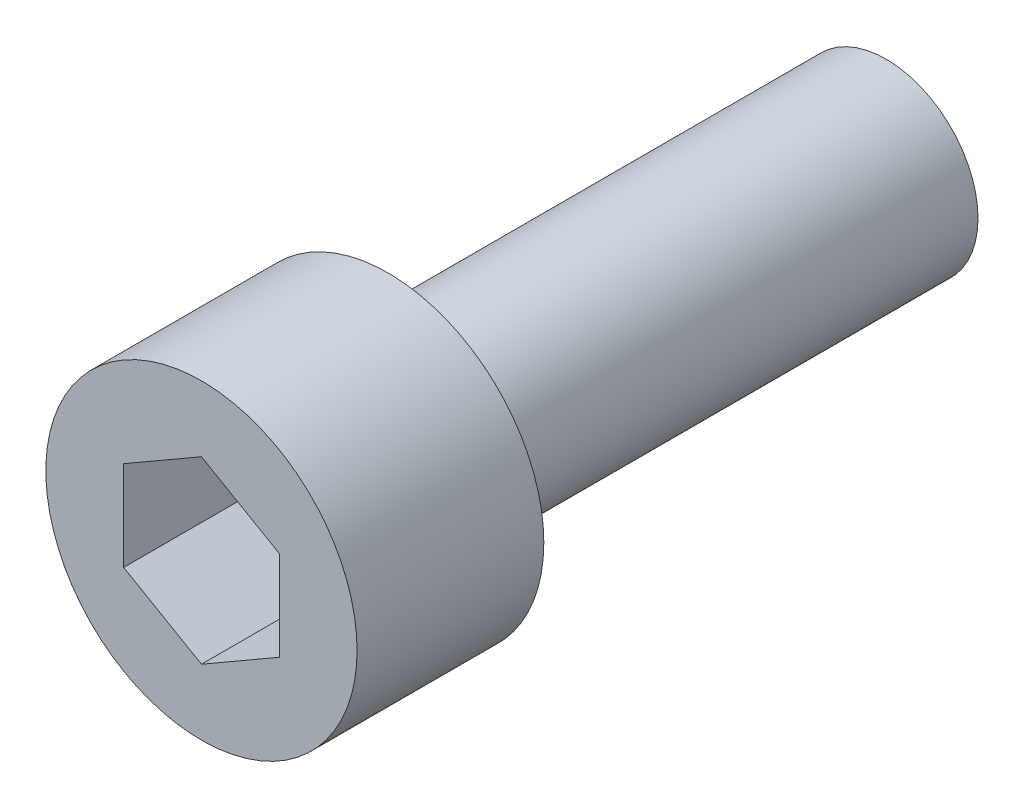
from build123d import *

# Parameters (mm, degrees)
SKETCH_1_R                     = 2.95
SHANK_THREADS_SIMPLIFIED_DEPTH = 16
SKETCH_2_R                     = 5
SOCKET_HEAD_DEPTH              = 6
HEX_SOCKET_DEPTH               = 3.9


with BuildPart() as part:
    # 草图1 → Shank_threads_simplified (new body)
    with BuildSketch(Plane.XY):
        Circle(SKETCH_1_R)
    extrude(amount=-SHANK_THREADS_SIMPLIFIED_DEPTH)

    # 草图2 → Socket_head (add)
    with BuildSketch(Plane.XY):
        Circle(SKETCH_2_R)
    extrude(amount=SOCKET_HEAD_DEPTH)

    # 草图3 → Hex_socket (cut)
    with BuildSketch(Plane.XY.offset(6)):
        Polygon((2.5, 1.443375673), (0, 2.886751346), (-2.5, 1.443375673), (-2.5, -1.443375673), (0, -2.886751346), (2.5, -1.443375673), align=None)
    extrude(amount=-HEX_SOCKET_DEPTH, mode=Mode.SUBTRACT)


solid = part.part
